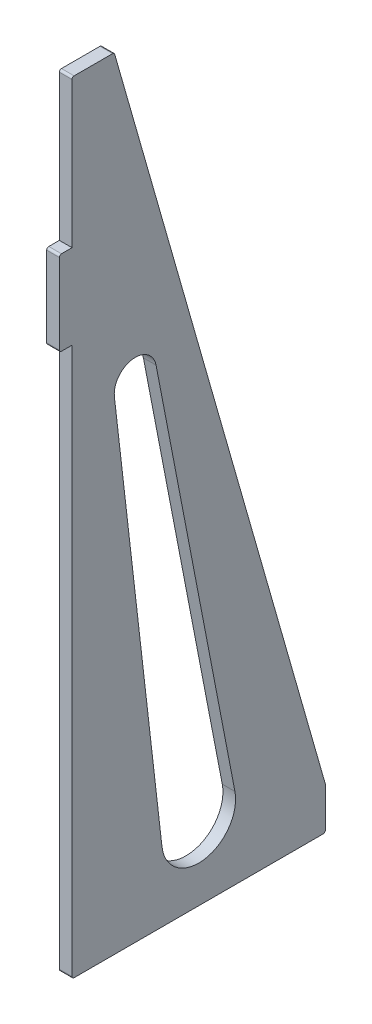
from build123d import *

# Parameters (mm, degrees)
CORNER_DEPTH = 6
SKETCH2_W    = 6
SKETCH2_H    = 70
SKETCH2_H_2  = 260
MOUNT_DEPTH  = 10
FILLET1_R    = 1
LITE_DEPTH   = 391.911754748


with BuildPart() as part:
    # Sketch1 → corner (new body)
    with BuildSketch(Plane(origin=(0, 0, 0), x_dir=(0, 0, -1), z_dir=(1, 0, 0))):
        Polygon((0, 0), (0, 370), (26, 370), (126, 20), (126, 0), align=None)
    extrude(amount=CORNER_DEPTH)

    # Sketch2 → mount (cut)
    with BuildSketch(Plane(origin=(6, 0, 0), x_dir=(0, 0, -1), z_dir=(1, 0, 0))):
        with Locations((3, 335)):
            Rectangle(SKETCH2_W, SKETCH2_H)
        with Locations((3, 130)):
            Rectangle(SKETCH2_W, SKETCH2_H_2)
    extrude(amount=-MOUNT_DEPTH, mode=Mode.SUBTRACT)

    # Fillet1
    fillet1_edges = [part.edges().sort_by_distance(p)[0] for p in [
        (3, 370, -6),
        (3, 300, 0),
        (3, 260, 0),
        (3, 0, -6),
        (3, 370, -26),
        (3, 20, -126),
        (3, 0, -126),
    ]]
    fillet(fillet1_edges, radius=FILLET1_R)

    # Sketch3 → lite (cut, through all)
    with BuildSketch(Plane(origin=(6, 0, 0), x_dir=(0, 0, -1), z_dir=(1, 0, 0))):
        with BuildLine():
            Line((26.065623551, 228.856249777), (48.614841214, 32.99843711))
            ThreePointArc((48.614841214, 32.99843711), (68.661000724, 17.703495291), (83.182846647, 38.316591792))
            Line((83.182846647, 38.316591792), (45.818769512, 231.89519531))
            ThreePointArc((45.818769512, 231.89519531), (34.479428157, 239.883716977), (26.065623551, 228.856249777))
        make_face()
    extrude(amount=-LITE_DEPTH, mode=Mode.SUBTRACT)


solid = part.part
